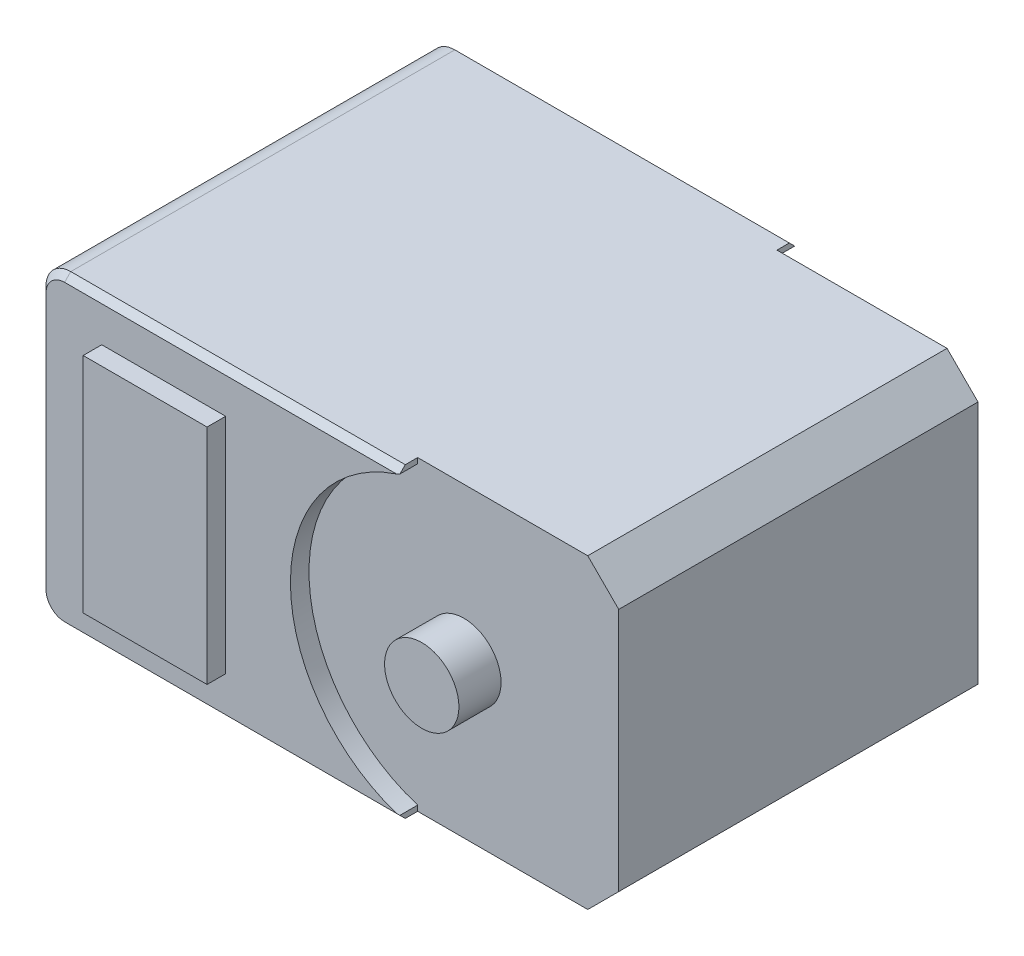
from build123d import *

# Parameters (mm, degrees)
SKETCH_1_W           = 45.23
SKETCH_1_H           = 24.73
EXTRUDE_1_DEPTH      = 35
CUT_EXTRUDE_1_DEPTH  = 3
SKETCH_5_W           = 1.897849624
SKETCH_5_H           = 24.73
CUT_EXTRUDE_3_DEPTH  = 3
EXTRUDE_2_DEPTH      = 17.9
EXTRUDE_2_DEPTH_BACK = 18.6
EXTRUDE_2_START      = 17.5
SKETCH_3_R           = 3
SKETCH_4_W           = 30.897849624
SKETCH_4_H           = 5
CUT_EXTRUDE_2_DEPTH  = 1.5
CHAMFER_1_SIZE       = 2.5
FILLET_1_R           = 2
SKETCH_6_W           = 10
SKETCH_6_H           = 18
CUT_EXTRUDE_4_DEPTH  = 1.5
CHAMFER_2_SIZE       = 0.5


with BuildPart() as part:
    # 草图1 → 凸台-拉伸1 (new body)
    with BuildSketch(Plane.XY):
        with Locations((22.615, 12.365)):
            Rectangle(SKETCH_1_W, SKETCH_1_H)
    extrude(amount=EXTRUDE_1_DEPTH)

    # 草图2 → 切除-拉伸1 (cut)
    with BuildSketch(Plane.XY):
        with BuildLine():
            Line((45.23, 24.73), (30.897849624, 24.73))
            ThreePointArc((30.897849624, 24.73), (20.23, 12.365), (30.897849624, 0))
            Line((30.897849624, 0), (45.23, 0))
            Line((45.23, 0), (45.23, 24.73))
        make_face()
    cut_extrude_1 = extrude(amount=CUT_EXTRUDE_1_DEPTH, mode=Mode.SUBTRACT)

    # 草图5 → 切除-拉伸3 (cut)
    with BuildSketch(Plane.XY):
        with Locations((29.948924812, 12.365)):
            Rectangle(SKETCH_5_W, SKETCH_5_H)
    cut_extrude_3 = extrude(amount=CUT_EXTRUDE_3_DEPTH, mode=Mode.SUBTRACT)

    # 镜向1: 切除-拉伸1, 切除-拉伸3 across plane
    add(cut_extrude_1.mirror(Plane.XY.offset(17.5)), mode=Mode.SUBTRACT)
    add(cut_extrude_3.mirror(Plane.XY.offset(17.5)), mode=Mode.SUBTRACT)

    # 草图3 → 凸台-拉伸2 (add, two sides: drawn at the far end of the back side and taken through both)
    with BuildSketch(Plane.XY.offset(EXTRUDE_2_START - EXTRUDE_2_DEPTH_BACK)):
        with Locations((32.73, 12.365)):
            Circle(SKETCH_3_R)
    extrude(amount=EXTRUDE_2_DEPTH + EXTRUDE_2_DEPTH_BACK)

    # 草图4 → 切除-拉伸2 (cut)
    with BuildSketch(Plane.XY):
        with Locations((15.448924812, 22.23)):
            Rectangle(SKETCH_4_W, SKETCH_4_H)
        with Locations((15.448924812, 2.5)):
            Rectangle(SKETCH_4_W, SKETCH_4_H)
    extrude(amount=CUT_EXTRUDE_2_DEPTH, mode=Mode.SUBTRACT)

    # 倒角1
    chamfer_1_edges = [part.edges().sort_by_distance(p)[0] for p in [
        (45.23, 0, 17.5),
        (45.23, 24.73, 17.5),
    ]]
    chamfer(chamfer_1_edges, length=CHAMFER_1_SIZE)

    # 圆角1
    fillet_1_edges = [part.edges().sort_by_distance(p)[0] for p in [
        (0, 24.73, 18.25),
        (0, 0, 18.25),
    ]]
    fillet(fillet_1_edges, radius=FILLET_1_R)

    # 草图6 → 切除-拉伸4 (cut)
    with BuildSketch(Plane.XY.offset(35)):
        with BuildLine():
            Line((29, 24.73), (2, 24.73))
            ThreePointArc((2, 24.73), (0.585786438, 24.144213562), (0, 22.73))
            Line((0, 22.73), (0, 2))
            ThreePointArc((0, 2), (0.585786438, 0.585786438), (2, 0))
            Line((2, 0), (29, 0))
            Line((29, 0), (29, 0.434488695))
            ThreePointArc((29, 0.434488695), (20.23, 12.365), (29, 24.295511305))
            Line((29, 24.295511305), (29, 24.73))
        make_face()
        with Locations((10, 12.365)):
            Rectangle(SKETCH_6_W, SKETCH_6_H, mode=Mode.SUBTRACT)
    extrude(amount=-CUT_EXTRUDE_4_DEPTH, mode=Mode.SUBTRACT)

    # 倒角2
    chamfer_2_edges = [part.edges().sort_by_distance(p)[0] for p in [
        (0, 21.23, 1.5),
        (15.5, 24.73, 1.5),
        (0, 12.365, 0),
        (0, 3.5, 1.5),
        (15.5, 0, 1.5),
        (15.5, 24.73, 33.5),
        (15.5, 0, 33.5),
    ]]
    chamfer(chamfer_2_edges, length=CHAMFER_2_SIZE)


solid = part.part
